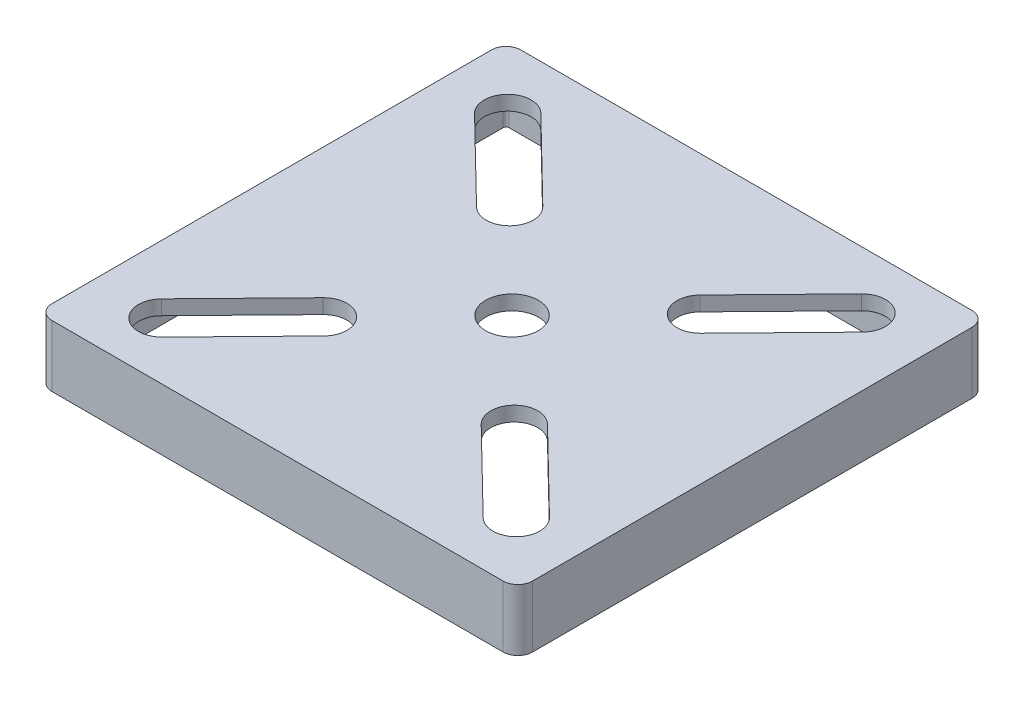
from build123d import *

# Parameters (mm, degrees)
SKETCH1_R           = 9
BOSS_EXTRUDE1_DEPTH = 21
SHELL1_T            = -4
MOVE_FACE1_BY       = 1
SKETCH1_4_R         = 9
CUT_EXTRUDE1_DEPTH  = 117.468879964
SKETCH2_R           = 9
BOSS_EXTRUDE2_DEPTH = 2


with BuildPart() as part:
    # Sketch1 → Boss-Extrude1 (new body)
    # profile 1 of 6: a face of its own
    with BuildSketch(Plane(origin=(0, 0, 0), x_dir=(1, 0, 0), z_dir=(0, 1, 0))):
        with BuildLine():
            ThreePointArc((-82, 75), (-80.535533906, 78.535533906), (-77, 80))
            Line((-77, 80), (77, 80))
            ThreePointArc((77, 80), (80.535533906, 78.535533906), (82, 75))
            Line((82, 75), (82, -75))
            ThreePointArc((82, -75), (80.535533906, -78.535533906), (77, -80))
            Line((77, -80), (-77, -80))
            ThreePointArc((-77, -80), (-80.535533906, -78.535533906), (-82, -75))
            Line((-82, -75), (-82, 75))
        make_face()
        Circle(SKETCH1_R, mode=Mode.SUBTRACT)
        with BuildLine():
            Line((-54.889206332, 64.727033293), (-26.973710346, 37.492403062))
            ThreePointArc((-26.973710346, 37.492403062), (-26.834045575, 26.179556659), (-38.146891979, 26.039891888))
            Line((-38.146891979, 26.039891888), (-66.062387966, 53.274522119))
            ThreePointArc((-66.062387966, 53.274522119), (-66.202052736, 64.587368523), (-54.889206332, 64.727033293))
        make_face(mode=Mode.SUBTRACT)
        with BuildLine():
            Line((53.274522119, 66.062387966), (26.039891888, 38.146891979))
            ThreePointArc((26.039891888, 38.146891979), (26.179556659, 26.834045575), (37.492403062, 26.973710346))
            Line((37.492403062, 26.973710346), (64.727033293, 54.889206332))
            ThreePointArc((64.727033293, 54.889206332), (64.587368523, 66.202052736), (53.274522119, 66.062387966))
        make_face(mode=Mode.SUBTRACT)
        with BuildLine():
            Line((66.062387966, -53.274522119), (38.146891979, -26.039891888))
            ThreePointArc((38.146891979, -26.039891888), (26.834045575, -26.179556659), (26.973710346, -37.492403062))
            Line((26.973710346, -37.492403062), (54.889206332, -64.727033293))
            ThreePointArc((54.889206332, -64.727033293), (66.202052736, -64.587368523), (66.062387966, -53.274522119))
        make_face(mode=Mode.SUBTRACT)
        with BuildLine():
            Line((-53.274522119, -66.062387966), (-26.039891888, -38.146891979))
            ThreePointArc((-26.039891888, -38.146891979), (-26.179556659, -26.834045575), (-37.492403062, -26.973710346))
            Line((-37.492403062, -26.973710346), (-64.727033293, -54.889206332))
            ThreePointArc((-64.727033293, -54.889206332), (-64.587368523, -66.202052736), (-53.274522119, -66.062387966))
        make_face(mode=Mode.SUBTRACT)
    # profile 2 of 6: a face of its own
    with BuildSketch(Plane(origin=(0, 0, 0), x_dir=(1, 0, 0), z_dir=(0, 1, 0))):
        with BuildLine():
            ThreePointArc((-26.973710346, 37.492403062), (-26.834045575, 26.179556659), (-38.146891979, 26.039891888))
            Line((-38.146891979, 26.039891888), (-66.062387966, 53.274522119))
            ThreePointArc((-66.062387966, 53.274522119), (-66.202052736, 64.587368523), (-54.889206332, 64.727033293))
            Line((-54.889206332, 64.727033293), (-26.973710346, 37.492403062))
        make_face()
    # profile 3 of 6: a face of its own
    with BuildSketch(Plane(origin=(0, 0, 0), x_dir=(1, 0, 0), z_dir=(0, 1, 0))):
        with BuildLine():
            ThreePointArc((-53.274522119, -66.062387966), (-64.587368523, -66.202052736), (-64.727033293, -54.889206332))
            Line((-64.727033293, -54.889206332), (-37.492403062, -26.973710346))
            ThreePointArc((-37.492403062, -26.973710346), (-26.179556659, -26.834045575), (-26.039891888, -38.146891979))
            Line((-26.039891888, -38.146891979), (-53.274522119, -66.062387966))
        make_face()
    # profile 4 of 6: a face of its own
    with BuildSketch(Plane(origin=(0, 0, 0), x_dir=(1, 0, 0), z_dir=(0, 1, 0))):
        Circle(SKETCH1_R)
    # profile 5 of 6: a face of its own
    with BuildSketch(Plane(origin=(0, 0, 0), x_dir=(1, 0, 0), z_dir=(0, 1, 0))):
        with BuildLine():
            ThreePointArc((66.062387966, -53.274522119), (66.202052736, -64.587368523), (54.889206332, -64.727033293))
            Line((54.889206332, -64.727033293), (26.973710346, -37.492403062))
            ThreePointArc((26.973710346, -37.492403062), (26.834045575, -26.179556659), (38.146891979, -26.039891888))
            Line((38.146891979, -26.039891888), (66.062387966, -53.274522119))
        make_face()
    # profile 6 of 6: a face of its own
    with BuildSketch(Plane(origin=(0, 0, 0), x_dir=(1, 0, 0), z_dir=(0, 1, 0))):
        with BuildLine():
            ThreePointArc((53.274522119, 66.062387966), (64.587368523, 66.202052736), (64.727033293, 54.889206332))
            Line((64.727033293, 54.889206332), (37.492403062, 26.973710346))
            ThreePointArc((37.492403062, 26.973710346), (26.179556659, 26.834045575), (26.039891888, 38.146891979))
            Line((26.039891888, 38.146891979), (53.274522119, 66.062387966))
        make_face()
    extrude(amount=-BOSS_EXTRUDE1_DEPTH)

    # Shell1
    shell1_openings = [part.faces().sort_by_distance(p)[0] for p in [
        (0, -21, 0),
    ]]
    offset(amount=SHELL1_T, openings=shell1_openings, kind=Kind.INTERSECTION)

    # Move Face1: a face moved inward by 1.0
    extrude(part.faces().sort_by_distance((0, -4, 0))[0], amount=MOVE_FACE1_BY, dir=(0, 1, 0), mode=Mode.SUBTRACT)

    # Sketch1<4> → Cut-Extrude1 (cut, through all)
    with BuildSketch(Plane(origin=(0, 0, 0), x_dir=(1, 0, 0), z_dir=(0, 1, 0))):
        with BuildLine():
            ThreePointArc((-26.973710346, 37.492403062), (-26.834045575, 26.179556659), (-38.146891979, 26.039891888))
            Line((-38.146891979, 26.039891888), (-66.062387966, 53.274522119))
            ThreePointArc((-66.062387966, 53.274522119), (-66.202052736, 64.587368523), (-54.889206332, 64.727033293))
            Line((-54.889206332, 64.727033293), (-26.973710346, 37.492403062))
        make_face()
        with BuildLine():
            ThreePointArc((-53.274522119, -66.062387966), (-64.587368523, -66.202052736), (-64.727033293, -54.889206332))
            Line((-64.727033293, -54.889206332), (-37.492403062, -26.973710346))
            ThreePointArc((-37.492403062, -26.973710346), (-26.179556659, -26.834045575), (-26.039891888, -38.146891979))
            Line((-26.039891888, -38.146891979), (-53.274522119, -66.062387966))
        make_face()
        with BuildLine():
            ThreePointArc((66.062387966, -53.274522119), (66.202052736, -64.587368523), (54.889206332, -64.727033293))
            Line((54.889206332, -64.727033293), (26.973710346, -37.492403062))
            ThreePointArc((26.973710346, -37.492403062), (26.834045575, -26.179556659), (38.146891979, -26.039891888))
            Line((38.146891979, -26.039891888), (66.062387966, -53.274522119))
        make_face()
        with BuildLine():
            ThreePointArc((53.274522119, 66.062387966), (64.587368523, 66.202052736), (64.727033293, 54.889206332))
            Line((64.727033293, 54.889206332), (37.492403062, 26.973710346))
            ThreePointArc((37.492403062, 26.973710346), (26.179556659, 26.834045575), (26.039891888, 38.146891979))
            Line((26.039891888, 38.146891979), (53.274522119, 66.062387966))
        make_face()
        with Locations(Location((0, 0, 0), (0, 0, 270))):
            Circle(SKETCH1_4_R)
    extrude(amount=-CUT_EXTRUDE1_DEPTH, mode=Mode.SUBTRACT)

    # Sketch2 → Boss-Extrude2 (add)
    with BuildSketch(Plane.XZ.offset(3)):
        with BuildLine():
            Line((-5.774661215, 11.647029143), (-21.002387182, 27.255448258))
            ThreePointArc((-21.002387182, 27.255448258), (-19.914815745, 34.443366807), (-23.176764095, 40.940187387))
            Line((-23.176764095, 40.940187387), (-50.411394326, 68.855683374))
            ThreePointArc((-50.411394326, 68.855683374), (-67.380663931, 69.06518053), (-67.590161087, 52.095910924))
            Line((-67.590161087, 52.095910924), (-40.355530856, 24.180414937))
            ThreePointArc((-40.355530856, 24.180414937), (-33.94122007, 20.759069904), (-26.728642769, 21.668857441))
            Line((-26.728642769, 21.668857441), (-11.500916802, 6.060438326))
            ThreePointArc((-11.500916802, 6.060438326), (-12.999009411, 0.160481598), (-11.647029143, -5.774661215))
            Line((-11.647029143, -5.774661215), (-27.255448258, -21.002387182))
            ThreePointArc((-27.255448258, -21.002387182), (-34.443366807, -19.914815745), (-40.940187387, -23.176764095))
            Line((-40.940187387, -23.176764095), (-68.855683374, -50.411394326))
            ThreePointArc((-68.855683374, -50.411394326), (-69.06518053, -67.380663931), (-52.095910924, -67.590161087))
            Line((-52.095910924, -67.590161087), (-24.180414937, -40.355530856))
            ThreePointArc((-24.180414937, -40.355530856), (-20.759069904, -33.94122007), (-21.668857441, -26.728642769))
            Line((-21.668857441, -26.728642769), (-6.060438326, -11.500916802))
            ThreePointArc((-6.060438326, -11.500916802), (-0.160481598, -12.999009411), (5.774661215, -11.647029143))
            Line((5.774661215, -11.647029143), (21.002387182, -27.255448258))
            ThreePointArc((21.002387182, -27.255448258), (19.914815745, -34.443366807), (23.176764095, -40.940187387))
            Line((23.176764095, -40.940187387), (50.411394326, -68.855683374))
            ThreePointArc((50.411394326, -68.855683374), (67.380663931, -69.06518053), (67.590161087, -52.095910924))
            Line((67.590161087, -52.095910924), (40.355530856, -24.180414937))
            ThreePointArc((40.355530856, -24.180414937), (33.94122007, -20.759069904), (26.728642769, -21.668857441))
            Line((26.728642769, -21.668857441), (11.500916802, -6.060438326))
            ThreePointArc((11.500916802, -6.060438326), (12.999009411, -0.160481598), (11.647029143, 5.774661215))
            Line((11.647029143, 5.774661215), (27.255448258, 21.002387182))
            ThreePointArc((27.255448258, 21.002387182), (34.443366807, 19.914815745), (40.940187387, 23.176764095))
            Line((40.940187387, 23.176764095), (68.855683374, 50.411394326))
            ThreePointArc((68.855683374, 50.411394326), (69.06518053, 67.380663931), (52.095910924, 67.590161087))
            Line((52.095910924, 67.590161087), (24.180414937, 40.355530856))
            ThreePointArc((24.180414937, 40.355530856), (20.759069904, 33.94122007), (21.668857441, 26.728642769))
            Line((21.668857441, 26.728642769), (6.060438326, 11.500916802))
            ThreePointArc((6.060438326, 11.500916802), (0.160481598, 12.999009411), (-5.774661215, 11.647029143))
        make_face()
        with BuildLine():
            ThreePointArc((-54.889206332, -64.727033293), (-66.202052736, -64.587368523), (-66.062387966, -53.274522119))
            Line((-66.062387966, -53.274522119), (-38.146891979, -26.039891888))
            ThreePointArc((-38.146891979, -26.039891888), (-26.834045575, -26.179556659), (-26.973710346, -37.492403062))
            Line((-26.973710346, -37.492403062), (-54.889206332, -64.727033293))
        make_face(mode=Mode.SUBTRACT)
        with Locations(Location((0, 0, 0), (0, 0, 90))):
            Circle(SKETCH2_R, mode=Mode.SUBTRACT)
        with BuildLine():
            Line((-53.274522119, 66.062387966), (-26.039891888, 38.146891979))
            ThreePointArc((-26.039891888, 38.146891979), (-26.179556659, 26.834045575), (-37.492403062, 26.973710346))
            Line((-37.492403062, 26.973710346), (-64.727033293, 54.889206332))
            ThreePointArc((-64.727033293, 54.889206332), (-64.587368523, 66.202052736), (-53.274522119, 66.062387966))
        make_face(mode=Mode.SUBTRACT)
        with BuildLine():
            ThreePointArc((38.146891979, 26.039891888), (26.834045575, 26.179556659), (26.973710346, 37.492403062))
            Line((26.973710346, 37.492403062), (54.889206332, 64.727033293))
            ThreePointArc((54.889206332, 64.727033293), (66.202052736, 64.587368523), (66.062387966, 53.274522119))
            Line((66.062387966, 53.274522119), (38.146891979, 26.039891888))
        make_face(mode=Mode.SUBTRACT)
        with BuildLine():
            ThreePointArc((26.039891888, -38.146891979), (26.179556659, -26.834045575), (37.492403062, -26.973710346))
            Line((37.492403062, -26.973710346), (64.727033293, -54.889206332))
            ThreePointArc((64.727033293, -54.889206332), (64.587368523, -66.202052736), (53.274522119, -66.062387966))
            Line((53.274522119, -66.062387966), (26.039891888, -38.146891979))
        make_face(mode=Mode.SUBTRACT)
    extrude(amount=BOSS_EXTRUDE2_DEPTH)


solid = part.part
